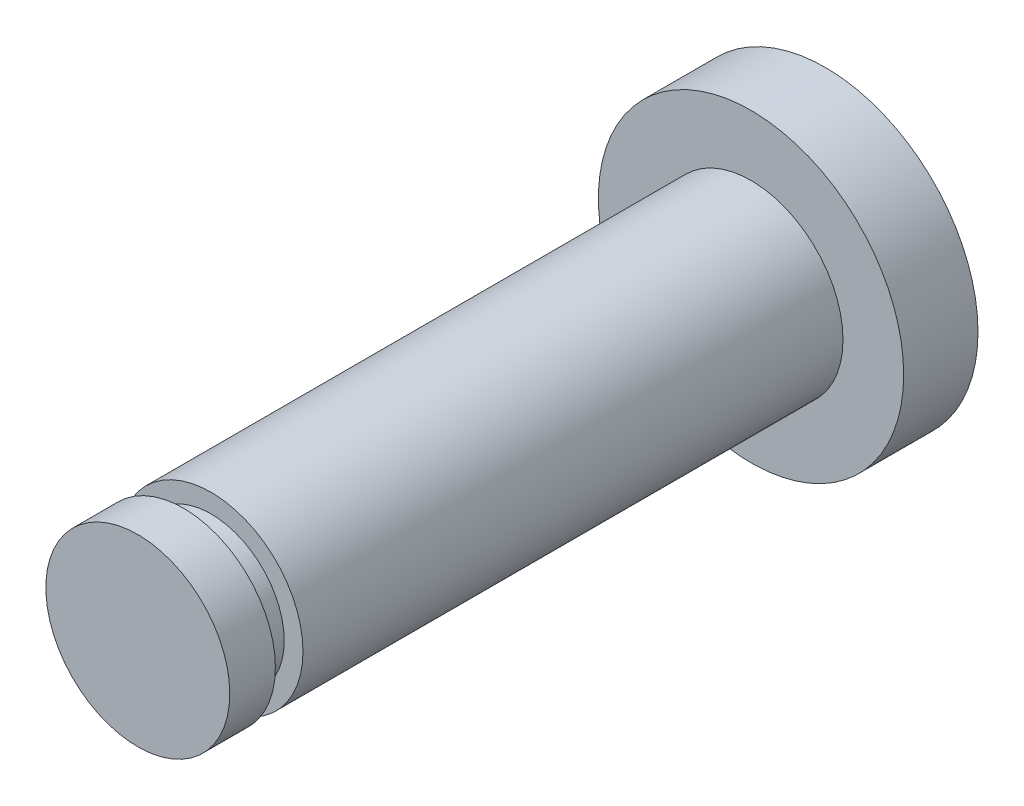
from build123d import *

# Parameters (mm, degrees)
F_01_START                           = -7.23
S01_SMOOTH_PIN_AND_END_MARGIN_R      = 2.5
F_01_SMOOTH_PIN_AND_END_MARGIN_DEPTH = 16.67
F_02_START                           = -9.25
S02_CLEVIS_PIN_HEAD_R                = 4.15
F_02_CLEVIS_PIN_HEAD_DEPTH           = 2.02
F_03_START                           = 7.45
S03_DE_4_RETAINING_GROOVE_R          = 2.6
S03_DE_4_RETAINING_GROOVE_R_2        = 1.99
F_03_DE_4_RETAINING_GROOVE_DEPTH     = 0.75


with BuildPart() as part:
    # S01 - Smooth pin and end margin → 01 - Smooth pin and end margin (new body)
    with BuildSketch(Plane.XY.offset(F_01_START)):
        Circle(S01_SMOOTH_PIN_AND_END_MARGIN_R)
    extrude(amount=F_01_SMOOTH_PIN_AND_END_MARGIN_DEPTH)

    # S02 - Clevis pin head → 02 - Clevis pin head (add)
    with BuildSketch(Plane.XY.offset(F_02_START)):
        Circle(S02_CLEVIS_PIN_HEAD_R)
    extrude(amount=F_02_CLEVIS_PIN_HEAD_DEPTH)

    # S03 - DE-4 retaining groove → 03 - DE-4 retaining groove (cut)
    with BuildSketch(Plane.XY.offset(F_03_START)):
        Circle(S03_DE_4_RETAINING_GROOVE_R)
        Circle(S03_DE_4_RETAINING_GROOVE_R_2, mode=Mode.SUBTRACT)
    extrude(amount=F_03_DE_4_RETAINING_GROOVE_DEPTH, mode=Mode.SUBTRACT)


solid = part.part
